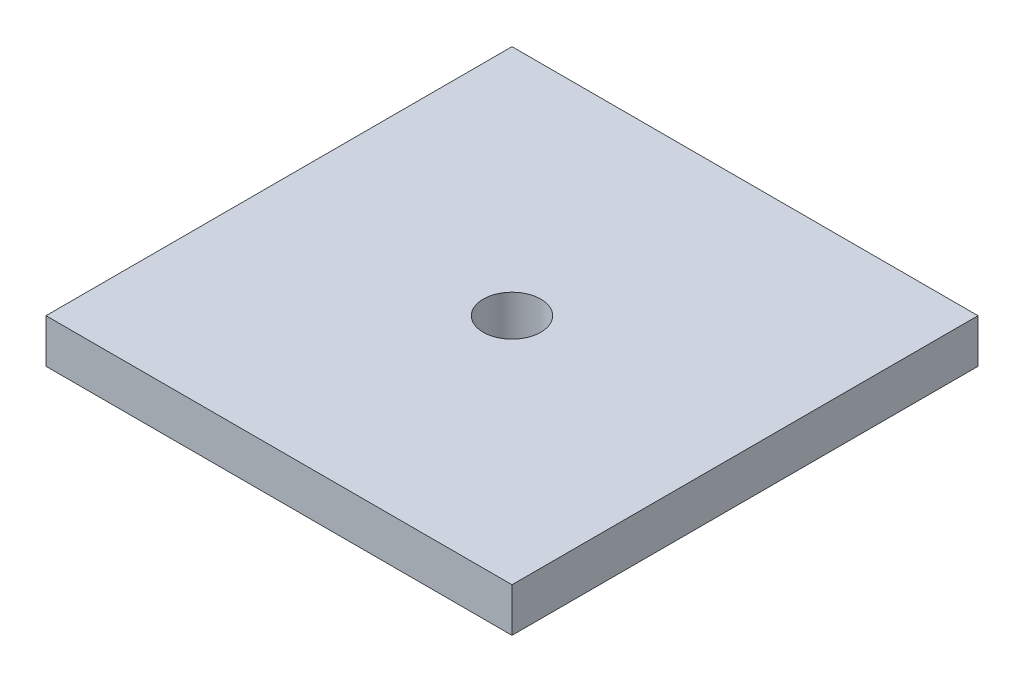
from build123d import *

# Parameters (mm, degrees)
SKETCH_7_W          = 17
SKETCH_7_H          = 17
EXTRUDE_5_DEPTH     = 1.6
SKETCH_12_R         = 1.05
CUT_EXTRUDE_3_DEPTH = 13.126829759


with BuildPart() as part:
    # 草图7 → 凸台-拉伸5 (new body)
    with BuildSketch(Plane(origin=(0, 0, 0), x_dir=(1, 0, 0), z_dir=(0, 1, 0))):
        Rectangle(SKETCH_7_W, SKETCH_7_H)
    extrude(amount=-EXTRUDE_5_DEPTH)

    # 草图12 → 切除-拉伸3 (cut, through all)
    with BuildSketch(Plane(origin=(0, 0, 0), x_dir=(1, 0, 0), z_dir=(0, 1, 0))):
        with Locations(Location((0, 0, 0), (0, 0, 270))):
            Circle(SKETCH_12_R)
    extrude(amount=-CUT_EXTRUDE_3_DEPTH, mode=Mode.SUBTRACT)


solid = part.part
